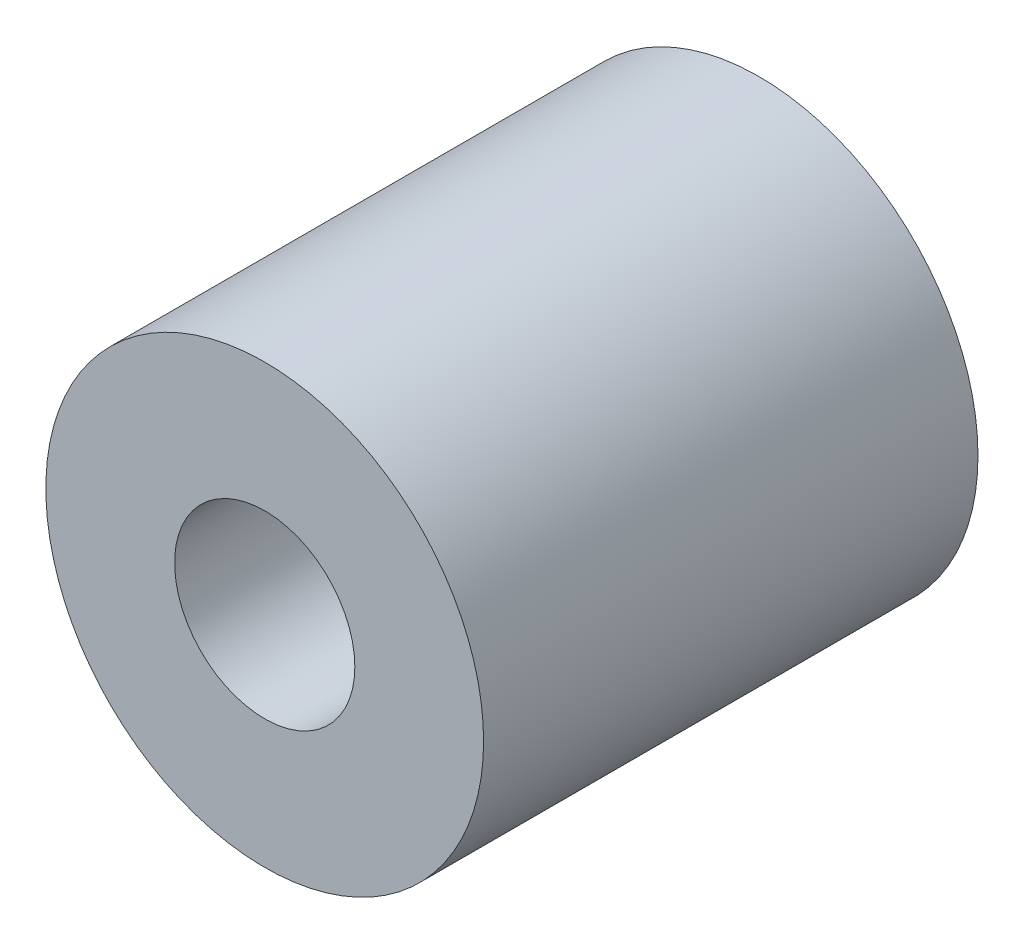
from build123d import *

# Parameters (mm, degrees)
SKETCH1_R                       = 17
SKETCH1_R_2                     = 3
D6_CLAMP_HUB_ENVELOPE_DEPTH     = 17
D14_HUB_AND_DISC_ENVELOPE_START = 17
SKETCH2_R                       = 17
SKETCH2_R_2                     = 7
D14_HUB_AND_DISC_ENVELOPE_DEPTH = 21.4


with BuildPart() as part:
    # Sketch1 → D6_Clamp_Hub_Envelope (new body)
    with BuildSketch(Plane.XY):
        Circle(SKETCH1_R)
        Circle(SKETCH1_R_2, mode=Mode.SUBTRACT)
    extrude(amount=D6_CLAMP_HUB_ENVELOPE_DEPTH)

    # Sketch2 → D14_Hub_And_Disc_Envelope (add)
    with BuildSketch(Plane.XY.offset(D14_HUB_AND_DISC_ENVELOPE_START)):
        Circle(SKETCH2_R)
        Circle(SKETCH2_R_2, mode=Mode.SUBTRACT)
    extrude(amount=D14_HUB_AND_DISC_ENVELOPE_DEPTH)


solid = part.part
